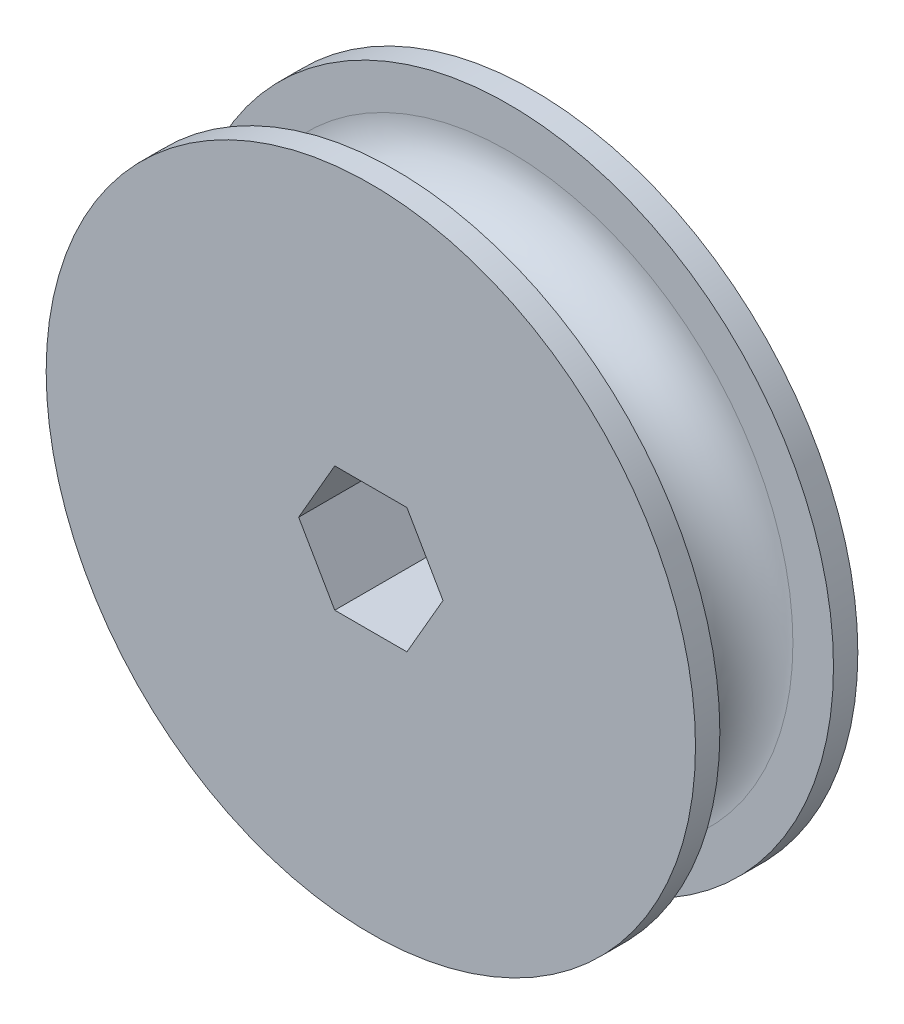
from build123d import *

# Parameters (mm, degrees)
SKETCH1_R           = 25.4
BOSS_EXTRUDE1_DEPTH = 6.35
CUT_EXTRUDE1_DEPTH  = 39.1


with BuildPart() as part:
    # Sketch1 → Boss-Extrude1 (new, symmetric)
    with BuildSketch(Plane.XY):
        Circle(SKETCH1_R)
    extrude(amount=BOSS_EXTRUDE1_DEPTH, both=True)

    # Sketch3 → Cut-Revolve1 (revolve, cut)
    with BuildSketch(Plane(origin=(0, 0, 0), x_dir=(1, 0, 0), z_dir=(0, 1, 0)), mode=Mode.PRIVATE) as cut_revolve1_sk:
        with BuildLine():
            Line((-25.4, 4.445), (-25.4, -4.445))
            Line((-25.4, -4.445), (-22.225, -4.445))
            ThreePointArc((-22.225, -4.445), (-17.78, 0), (-22.225, 4.445))
            Line((-22.225, 4.445), (-25.4, 4.445))
        make_face()
    revolve(cut_revolve1_sk.sketch.rotate(Axis((0, 0, 17.119668281), (0, 0, -1)), 180), axis=Axis((0, 0, 17.119668281), (0, 0, -1)), mode=Mode.SUBTRACT)

    # Sketch4 → Cut-Extrude1 (cut, through all)
    with BuildSketch(Plane(origin=(0, 0, -6.35), x_dir=(-1, 0, 0), z_dir=(0, 0, -1))):
        Polygon((5.645908282, 0), (2.822954141, 4.8895), (-2.822954141, 4.8895), (-5.645908282, 0), (-2.822954141, -4.8895), (2.822954141, -4.8895), align=None)
    extrude(amount=-CUT_EXTRUDE1_DEPTH, mode=Mode.SUBTRACT)


solid = part.part
